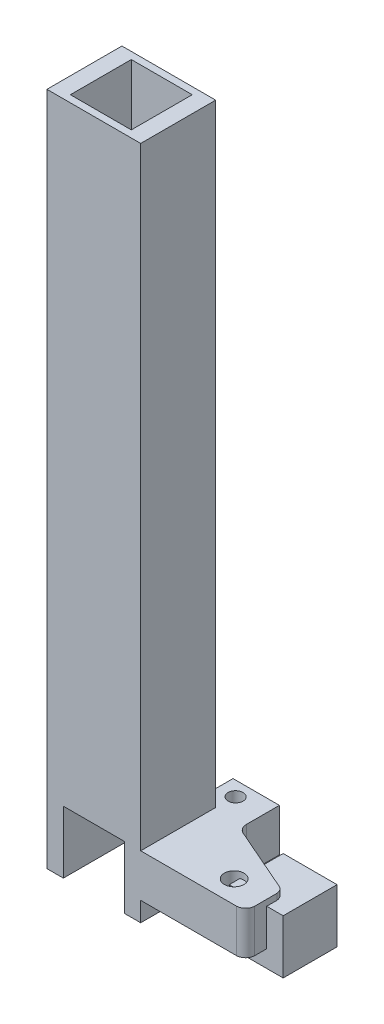
from build123d import *

# Parameters (mm, degrees)
SKETCH1_W           = 11.5
SKETCH1_H           = 11.5
BOSS_EXTRUDE1_DEPTH = 11.5
SKETCH2_W           = 20
SKETCH2_H           = 144
BOSS_EXTRUDE2_DEPTH = 16
SKETCH4_W           = 13
SKETCH4_H           = 13
CUT_EXTRUDE1_DEPTH  = 152.98237065
SKETCH5_W           = 13
SKETCH5_H           = 13.3
CUT_EXTRUDE2_DEPTH  = 1.5
SKETCH6_W           = 13
SKETCH6_H           = 8
CUT_EXTRUDE3_DEPTH  = 1.5
SKETCH10_W          = 16
SKETCH10_H          = 13.3
BOSS_EXTRUDE3_DEPTH = 3.79
SKETCH11_W          = 7.29
SKETCH11_H          = 13.3
BOSS_EXTRUDE4_DEPTH = 7.2
SKETCH12_R          = 1.6
CUT_EXTRUDE4_DEPTH  = 13.3
SKETCH13_W          = 3.79
SKETCH13_H          = 4.15
CUT_EXTRUDE6_DEPTH  = 16
SKETCH15_W          = 7.2
SKETCH15_H          = 4.15
CUT_EXTRUDE7_DEPTH  = 16
SKETCH17_W          = 16.6
SKETCH17_H          = 9.15
BOSS_EXTRUDE5_DEPTH = 18.6
CUT_EXTRUDE10_DEPTH = 18.6
SKETCH22_R          = 2.1
CUT_EXTRUDE11_DEPTH = 18.6
SKETCH24_W          = 2.604961471
SKETCH24_H          = 9.15
BOSS_EXTRUDE6_DEPTH = 6.6


with BuildPart() as part:
    # Sketch1 → Boss-Extrude1 (new body)
    with BuildSketch(Plane.XY):
        with Locations((-5.75, -5.75)):
            Rectangle(SKETCH1_W, SKETCH1_H)
    extrude(amount=BOSS_EXTRUDE1_DEPTH)


with BuildPart() as body_2:
    # Sketch2 → Boss-Extrude2 (new body)
    with BuildSketch(Plane.XY):
        with Locations((-35.898158877, 60)):
            Rectangle(SKETCH2_W, SKETCH2_H)
    extrude(amount=BOSS_EXTRUDE2_DEPTH)

    # Sketch4 → Cut-Extrude1 (cut, through all)
    with BuildSketch(Plane(origin=(0, 132, 0), x_dir=(1, 0, 0), z_dir=(0, 1, 0))):
        with Locations((-35.898158877, -8)):
            Rectangle(SKETCH4_W, SKETCH4_H)
    extrude(amount=-CUT_EXTRUDE1_DEPTH, mode=Mode.SUBTRACT)

    # Sketch5 → Cut-Extrude2 (cut)
    with BuildSketch(Plane.XY.offset(16)):
        with Locations((-35.898158877, -5.35)):
            Rectangle(SKETCH5_W, SKETCH5_H)
    extrude(amount=-CUT_EXTRUDE2_DEPTH, mode=Mode.SUBTRACT)

    # Sketch6 → Cut-Extrude3 (cut)
    with BuildSketch(Plane(origin=(0, 0, 0), x_dir=(-1, 0, 0), z_dir=(0, 0, -1))):
        with Locations((35.898158877, -8)):
            Rectangle(SKETCH6_W, SKETCH6_H)
    extrude(amount=-CUT_EXTRUDE3_DEPTH, mode=Mode.SUBTRACT)

    # Sketch10 → Boss-Extrude3 (add)
    with BuildSketch(Plane(origin=(-25.898158877, 0, 0), x_dir=(0, 0, -1), z_dir=(1, 0, 0))):
        with Locations((-8, -5.35)):
            Rectangle(SKETCH10_W, SKETCH10_H)
    extrude(amount=BOSS_EXTRUDE3_DEPTH)

    # Sketch11 → Boss-Extrude4 (add)
    with BuildSketch(Plane(origin=(0, 0, 0), x_dir=(-1, 0, 0), z_dir=(0, 0, -1))):
        with Locations((25.753158877, -5.35)):
            Rectangle(SKETCH11_W, SKETCH11_H)
    extrude(amount=BOSS_EXTRUDE4_DEPTH)

    # Sketch12 → Cut-Extrude4 (cut)
    with BuildSketch(Plane(origin=(0, 1.3, 0), x_dir=(1, 0, 0), z_dir=(0, 1, 0))):
        with Locations(Location((-25.753158877, 4.1, 0), (0, 0, 270))):
            Circle(SKETCH12_R)
    extrude(amount=-CUT_EXTRUDE4_DEPTH, mode=Mode.SUBTRACT)

    # Sketch13 → Cut-Extrude6 (cut)
    with BuildSketch(Plane.XY.offset(16)):
        with Locations((-24.003158877, -9.925)):
            Rectangle(SKETCH13_W, SKETCH13_H)
    extrude(amount=-CUT_EXTRUDE6_DEPTH, mode=Mode.SUBTRACT)

    # Sketch15 → Cut-Extrude7 (cut)
    with BuildSketch(Plane(origin=(-22.108158877, 0, 0), x_dir=(0, 0, -1), z_dir=(1, 0, 0))):
        with Locations((3.6, -9.925)):
            Rectangle(SKETCH15_W, SKETCH15_H)
    extrude(amount=-CUT_EXTRUDE7_DEPTH, mode=Mode.SUBTRACT)

    # Sketch17 → Boss-Extrude5 (add)
    with BuildSketch(Plane(origin=(-22.108158877, 0, 0), x_dir=(0, 0, -1), z_dir=(1, 0, 0))):
        with Locations((-7.7, -3.275)):
            Rectangle(SKETCH17_W, SKETCH17_H)
    extrude(amount=BOSS_EXTRUDE5_DEPTH)

    # Sketch18 → Cut-Extrude10 (cut)
    with BuildSketch(Plane(origin=(0, 1.3, 0), x_dir=(1, 0, 0), z_dir=(0, 1, 0))):
        with BuildLine():
            ThreePointArc((-4.611682563, -7.76314008), (-3.843042235, -8.389419264), (-3.508158877, -9.322632373))
            Line((-3.508158877, -9.322632373), (-3.508158877, 0.6))
            Line((-3.508158877, 0.6), (-19.503197406, 0.6))
            Line((-19.503197406, 0.6), (-19.503197406, 0.15803115))
            ThreePointArc((-19.503197406, 0.15803115), (-19.152542434, -1.018768523), (-18.214957899, -1.81170712))
            Line((-18.214957899, -1.81170712), (-4.611682563, -7.76314008))
        make_face()
        with BuildLine():
            ThreePointArc((-3.508158877, -14.140788033), (-4.139668174, -15.463143203), (-5.503197406, -16))
            Line((-5.503197406, -16), (-3.508158877, -16))
            Line((-3.508158877, -16), (-3.508158877, -14.140788033))
        make_face()
    extrude(amount=-CUT_EXTRUDE10_DEPTH, mode=Mode.SUBTRACT)

    # Sketch22 → Cut-Extrude11 (cut)
    with BuildSketch(Plane(origin=(0, 1.3, 0), x_dir=(1, 0, 0), z_dir=(0, 1, 0))):
        with Locations(Location((-10.753197406, -11.2, 0), (0, 0, 270))):
            Circle(SKETCH22_R)
    extrude(amount=-CUT_EXTRUDE11_DEPTH, mode=Mode.SUBTRACT)

    # Sketch24 → Boss-Extrude6 (add)
    with BuildSketch(Plane(origin=(0, 0, -0.6), x_dir=(-1, 0, 0), z_dir=(0, 0, -1))):
        with Locations((20.805678142, -3.275)):
            Rectangle(SKETCH24_W, SKETCH24_H)
    extrude(amount=BOSS_EXTRUDE6_DEPTH)


solid = Compound([part.part, body_2.part])
